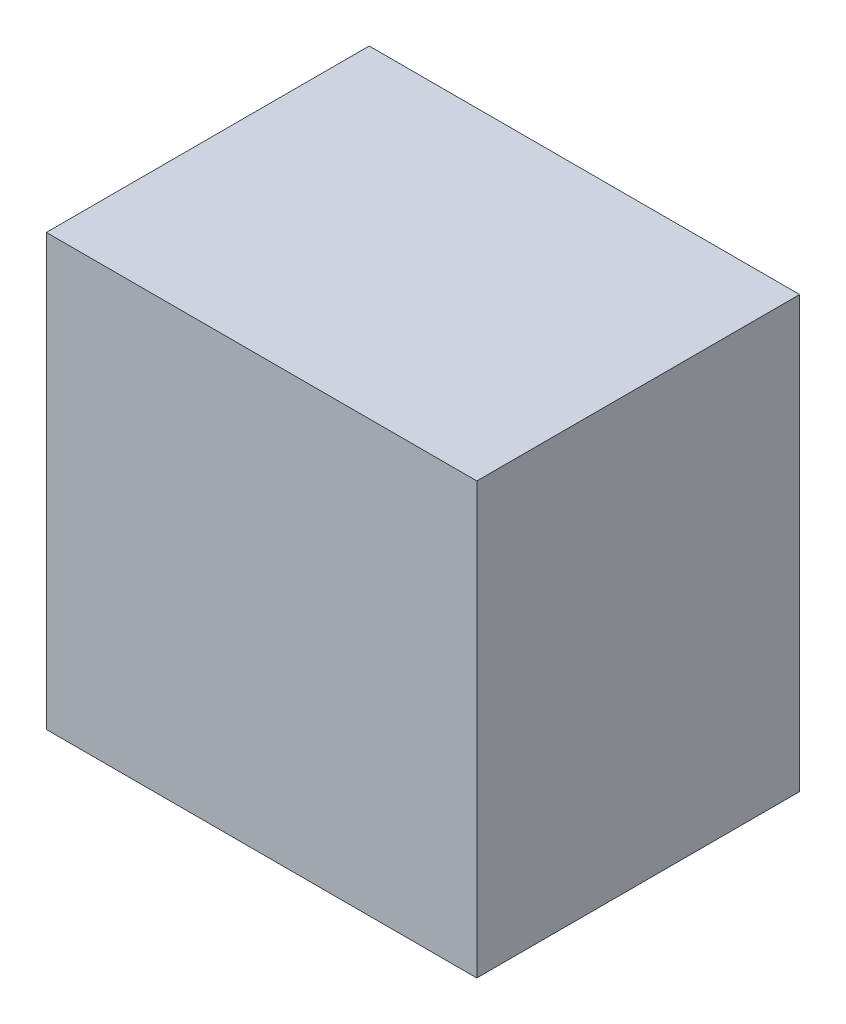
from build123d import *

# Parameters (mm, degrees)
DET_MOTORLU_RAY_M12_SOKET_1_START = -740
SKETCH1_W                         = 16
SKETCH1_H                         = 16
DET_MOTORLU_RAY_M12_SOKET_1_DEPTH = 12


with BuildPart() as part:
    # Sketch1 → DET_MOTORLU_RAY_M12_soket_1 (new body)
    with BuildSketch(Plane.XY.offset(DET_MOTORLU_RAY_M12_SOKET_1_START)):
        with Locations((734, 1547)):
            Rectangle(SKETCH1_W, SKETCH1_H)
    extrude(amount=-DET_MOTORLU_RAY_M12_SOKET_1_DEPTH)


solid = part.part
